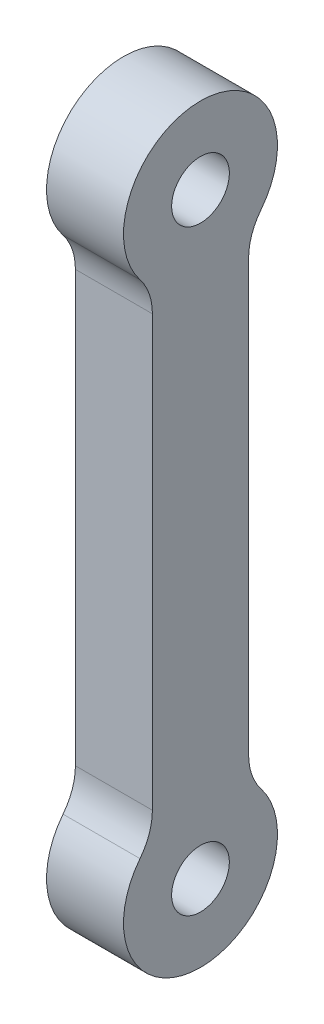
from build123d import *

# Parameters (mm, degrees)
SKETCH1_R           = 1.5
BOSS_EXTRUDE1_DEPTH = 4


with BuildPart() as part:
    # Sketch1 → Boss-Extrude1 (new body)
    with BuildSketch(Plane.YZ):
        with BuildLine():
            Line((11.169872981, -2.5), (-11.169872981, -2.5))
            ThreePointArc((-11.169872981, -2.5), (-12.151853487, -2.665266452), (-13.025641703, -3.142857143))
            ThreePointArc((-13.025641703, -3.142857143), (-19.5, 0), (-13.025641703, 3.142857143))
            ThreePointArc((-13.025641703, 3.142857143), (-12.151853487, 2.665266452), (-11.169872981, 2.5))
            Line((-11.169872981, 2.5), (11.169872981, 2.5))
            ThreePointArc((11.169872981, 2.5), (12.151853487, 2.665266452), (13.025641703, 3.142857143))
            ThreePointArc((13.025641703, 3.142857143), (19.5, 0), (13.025641703, -3.142857143))
            ThreePointArc((13.025641703, -3.142857143), (12.151853487, -2.665266452), (11.169872981, -2.5))
        make_face()
        with Locations(Location((-15.5, 0, 0), (0, 0, 270))):
            Circle(SKETCH1_R, mode=Mode.SUBTRACT)
        with Locations(Location((15.5, 0, 0), (0, 0, 90))):
            Circle(SKETCH1_R, mode=Mode.SUBTRACT)
    extrude(amount=BOSS_EXTRUDE1_DEPTH)


solid = part.part
